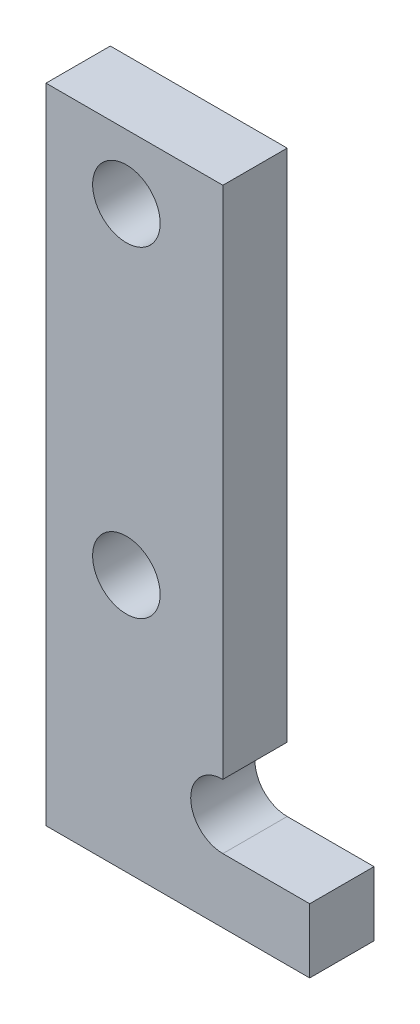
from build123d import *

# Parameters (mm, degrees)
SKETCH_1_W          = 5
SKETCH_1_H          = 20
EXTRUDE_1_DEPTH     = 2
SKETCH_2_W          = 2.7
SKETCH_2_H          = 2
EXTRUDE_2_DEPTH     = 2
SKETCH_4_R          = 1.05
CUT_EXTRUDE_1_DEPTH = 2
SKETCH_5_R          = 1
CUT_EXTRUDE_2_DEPTH = 12
SKETCH_6_W          = 0.5
SKETCH_6_H          = 20
EXTRUDE_3_DEPTH     = 2


with BuildPart() as part:
    # 草图1 → 凸台-拉伸1 (new body)
    with BuildSketch(Plane.XY):
        Rectangle(SKETCH_1_W, SKETCH_1_H)
    extrude(amount=EXTRUDE_1_DEPTH)

    # 草图2 → 凸台-拉伸2 (add)
    with BuildSketch(Plane.XY.offset(2)):
        with Locations((3.85, -9)):
            Rectangle(SKETCH_2_W, SKETCH_2_H)
    extrude(amount=-EXTRUDE_2_DEPTH)

    # 草图4 → 切除-拉伸1 (cut)
    with BuildSketch(Plane.XY.offset(2)):
        with Locations((-0.5, -2)):
            Circle(SKETCH_4_R)
        with Locations((-0.5, 8)):
            Circle(SKETCH_4_R)
    extrude(amount=-CUT_EXTRUDE_1_DEPTH, mode=Mode.SUBTRACT)

    # 草图5 → 切除-拉伸2 (cut)
    with BuildSketch(Plane.XY.offset(2)):
        with Locations((2.5, -7)):
            Circle(SKETCH_5_R)
    extrude(amount=-CUT_EXTRUDE_2_DEPTH, mode=Mode.SUBTRACT)

    # 草图6 → 凸台-拉伸3 (add)
    with BuildSketch(Plane.XY.offset(2)):
        with Locations((-2.75, 0)):
            Rectangle(SKETCH_6_W, SKETCH_6_H)
    extrude(amount=-EXTRUDE_3_DEPTH)


solid = part.part
